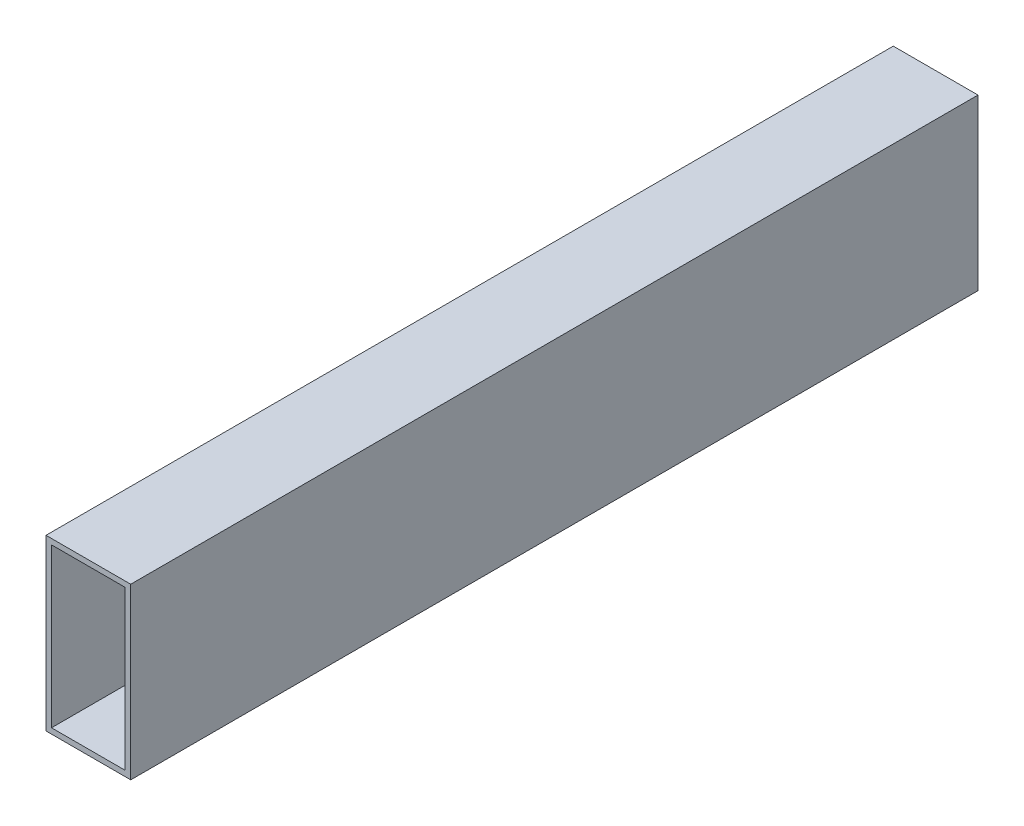
from build123d import *

# Parameters (mm, degrees)
SKETCH1_W           = 25.4
SKETCH1_H           = 50.8
BOSS_EXTRUDE1_DEPTH = 254
SKETCH2_W           = 22.098
SKETCH2_H           = 47.498
CUT_EXTRUDE1_DEPTH  = 261.334723249


with BuildPart() as part:
    # Sketch1 → Boss-Extrude1 (new body)
    with BuildSketch(Plane.XY):
        with Locations((-35.737209302, -4.799418605)):
            Rectangle(SKETCH1_W, SKETCH1_H)
    extrude(amount=BOSS_EXTRUDE1_DEPTH)

    # Sketch2 → Cut-Extrude1 (cut, through all)
    with BuildSketch(Plane.XY.offset(254)):
        with Locations((-35.737209302, -4.799418605)):
            Rectangle(SKETCH2_W, SKETCH2_H)
    extrude(amount=-CUT_EXTRUDE1_DEPTH, mode=Mode.SUBTRACT)


solid = part.part
